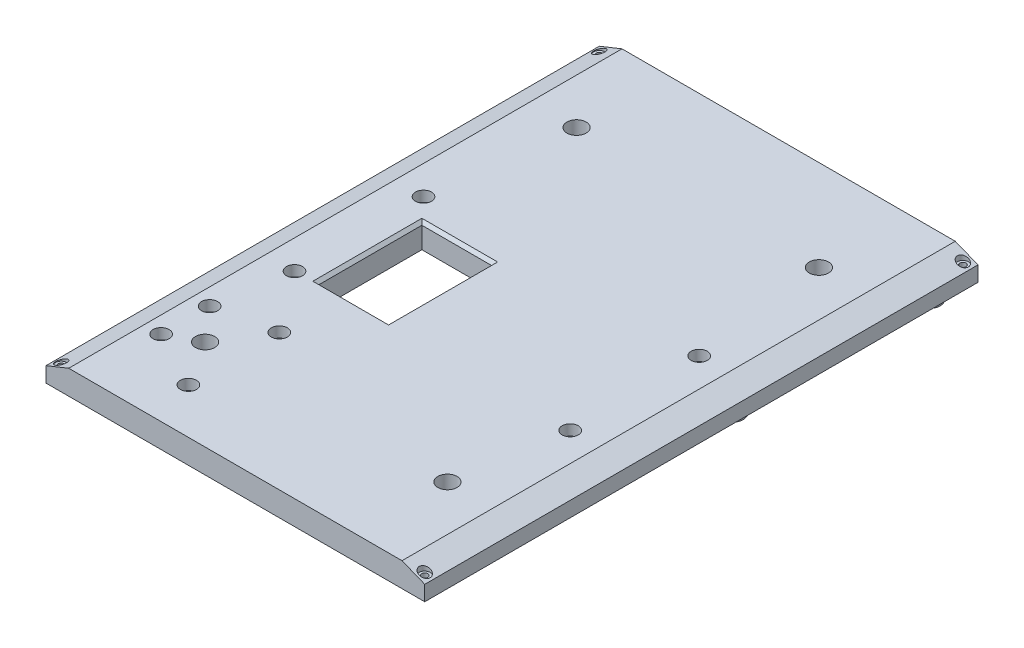
from build123d import *

# Parameters (mm, degrees)
BOSS_EXTRUDE1_DEPTH = 182.6
SKETCH2_R           = 2.5
SKETCH2_R_2         = 0.85
BOSS_EXTRUDE2_DEPTH = 3
SKETCH3_R           = 3.175
CUT_EXTRUDE1_DEPTH  = 15
SKETCH4_R           = 2.6
SKETCH4_R_2         = 1.55
BOSS_EXTRUDE3_DEPTH = 6
SKETCH7_R           = 1.6
CUT_EXTRUDE3_DEPTH  = 10
SKETCH8_R           = 1.6
CUT_EXTRUDE4_DEPTH  = 10
SKETCH6_R           = 0.85
CUT_EXTRUDE2_DEPTH  = 7
SKETCH9_R           = 3.5
SKETCH9_R_2         = 1.95
BOSS_EXTRUDE4_DEPTH = 5
SKETCH10_R          = 1.6
CUT_EXTRUDE5_DEPTH  = 10
SKETCH11_W          = 23
SKETCH11_H          = 34
CUT_EXTRUDE6_DEPTH  = 10
CHAMFER1_SIZE       = 1
SKETCH12_R          = 2.65
CUT_EXTRUDE7_DEPTH  = 3.5
SKETCH13_R          = 1.05
CUT_EXTRUDE8_DEPTH  = 8
SKETCH15_R          = 1.8
CUT_EXTRUDE9_DEPTH  = 3


with BuildPart() as part:
    # Sketch1 → Boss-Extrude1 (new body)
    with BuildSketch(Plane.XY):
        Polygon((0, 5), (7.5, 8), (117.5, 8), (125, 5), (125, 0), (0, 0), align=None)
    extrude(amount=BOSS_EXTRUDE1_DEPTH)

    # Sketch2 → Boss-Extrude2 (add)
    # profile 1 of 4: a face of its own
    with BuildSketch(Plane.XZ):
        with Locations(Location((40, 173.1, 0), (0, 0, 90))):
            Circle(SKETCH2_R)
        with Locations(Location((40, 173.1, 0), (0, 0, 270))):
            Circle(SKETCH2_R_2, mode=Mode.SUBTRACT)
    # profile 2 of 4: a face of its own
    with BuildSketch(Plane.XZ):
        with Locations(Location((98, 173.1, 0), (0, 0, 90))):
            Circle(SKETCH2_R)
        with Locations(Location((98, 173.1, 0), (0, 0, 270))):
            Circle(SKETCH2_R_2, mode=Mode.SUBTRACT)
    # profile 3 of 4: a face of its own
    with BuildSketch(Plane.XZ):
        with Locations(Location((98, 124.1, 0), (0, 0, 90))):
            Circle(SKETCH2_R)
        with Locations(Location((98, 124.1, 0), (0, 0, 90))):
            Circle(SKETCH2_R_2, mode=Mode.SUBTRACT)
    # profile 4 of 4: a face of its own
    with BuildSketch(Plane.XZ):
        with Locations(Location((40, 124.1, 0), (0, 0, 90))):
            Circle(SKETCH2_R)
        with Locations(Location((40, 124.1, 0), (0, 0, 90))):
            Circle(SKETCH2_R_2, mode=Mode.SUBTRACT)
    extrude(amount=BOSS_EXTRUDE2_DEPTH)

    # Sketch3 → Cut-Extrude1 (cut)
    with BuildSketch(Plane(origin=(0, 8, 0), x_dir=(1, 0, 0), z_dir=(0, 1, 0))):
        with Locations(Location((22.5, -152.6, 0), (0, 0, 270))):
            Circle(SKETCH3_R)
        with Locations(Location((102.5, -152.6, 0), (0, 0, 270))):
            Circle(SKETCH3_R)
        with Locations(Location((102.5, -30, 0), (0, 0, 270))):
            Circle(SKETCH3_R)
        with Locations(Location((22.5, -30, 0), (0, 0, 270))):
            Circle(SKETCH3_R)
    extrude(amount=-CUT_EXTRUDE1_DEPTH, mode=Mode.SUBTRACT)

    # Sketch4 → Boss-Extrude3 (add)
    # profile 1 of 4: a face of its own
    with BuildSketch(Plane.XZ):
        with Locations(Location((56.15, 81.14, 0), (0, 0, 90))):
            Circle(SKETCH4_R)
        with Locations(Location((56.15, 81.14, 0), (0, 0, 270))):
            Circle(SKETCH4_R_2, mode=Mode.SUBTRACT)
    # profile 2 of 4: a face of its own
    with BuildSketch(Plane.XZ):
        with Locations(Location((68.85, 81.14, 0), (0, 0, 90))):
            Circle(SKETCH4_R)
        with Locations(Location((68.85, 81.14, 0), (0, 0, 270))):
            Circle(SKETCH4_R_2, mode=Mode.SUBTRACT)
    # profile 3 of 4: a face of its own
    with BuildSketch(Plane.XZ):
        with Locations(Location((68.85, 101.46, 0), (0, 0, 90))):
            Circle(SKETCH4_R)
        with Locations(Location((68.85, 101.46, 0), (0, 0, 270))):
            Circle(SKETCH4_R_2, mode=Mode.SUBTRACT)
    # profile 4 of 4: a face of its own
    with BuildSketch(Plane.XZ):
        with Locations(Location((56.15, 101.46, 0), (0, 0, 90))):
            Circle(SKETCH4_R)
        with Locations(Location((56.15, 101.46, 0), (0, 0, 270))):
            Circle(SKETCH4_R_2, mode=Mode.SUBTRACT)
    extrude(amount=BOSS_EXTRUDE3_DEPTH)

    # Sketch7 → Cut-Extrude3 (cut)
    with BuildSketch(Plane(origin=(0, 8, 0), x_dir=(1, 0, 0), z_dir=(0, 1, 0))):
        with Locations(Location((17, -75.01, 0), (0, 0, 270))):
            Circle(SKETCH7_R)
        with Locations(Location((17, -117.585, 0), (0, 0, 270))):
            Circle(SKETCH7_R)
        with Locations(Location((108, -75.01, 0), (0, 0, 270))):
            Circle(SKETCH7_R)
        with Locations(Location((108, -117.59, 0), (0, 0, 270))):
            Circle(SKETCH7_R)
    extrude(amount=-CUT_EXTRUDE3_DEPTH, mode=Mode.SUBTRACT)

    # Sketch8 → Cut-Extrude4 (cut)
    with BuildSketch(Plane(origin=(0, 8, 0), x_dir=(1, 0, 0), z_dir=(0, 1, 0))):
        with Locations(Location((13, -141.6, 0), (0, 0, 270))):
            Circle(SKETCH8_R)
        with Locations(Location((13, -157.6, 0), (0, 0, 270))):
            Circle(SKETCH8_R)
    extrude(amount=-CUT_EXTRUDE4_DEPTH, mode=Mode.SUBTRACT)

    # Sketch6 → Cut-Extrude2 (cut)
    with BuildSketch(Plane.XZ):
        with Locations(Location((22.407582627, 118.246238122, 0), (0, 0, 270))):
            Circle(SKETCH6_R)
        with Locations(Location((48.407582627, 118.246238122, 0), (0, 0, 270))):
            Circle(SKETCH6_R)
        with Locations(Location((48.407582627, 71.246238122, 0), (0, 0, 270))):
            Circle(SKETCH6_R)
        with Locations(Location((22.407582627, 71.246238122, 0), (0, 0, 270))):
            Circle(SKETCH6_R)
    extrude(amount=-CUT_EXTRUDE2_DEPTH, mode=Mode.SUBTRACT)

    # Sketch9 → Boss-Extrude4 (add)
    # profile 1 of 4: a face of its own
    with BuildSketch(Plane.XZ):
        with Locations(Location((117, 73, 0), (0, 0, 90))):
            Circle(SKETCH9_R)
        with Locations(Location((117, 73, 0), (0, 0, 270))):
            Circle(SKETCH9_R_2, mode=Mode.SUBTRACT)
    # profile 2 of 4: a face of its own
    with BuildSketch(Plane.XZ):
        with Locations(Location((117, 8, 0), (0, 0, 90))):
            Circle(SKETCH9_R)
        with Locations(Location((117, 8, 0), (0, 0, 270))):
            Circle(SKETCH9_R_2, mode=Mode.SUBTRACT)
    # profile 3 of 4: a face of its own
    with BuildSketch(Plane.XZ):
        with Locations(Location((34, 8, 0), (0, 0, 90))):
            Circle(SKETCH9_R)
        with Locations(Location((34, 8, 0), (0, 0, 270))):
            Circle(SKETCH9_R_2, mode=Mode.SUBTRACT)
    # profile 4 of 4: a face of its own
    with BuildSketch(Plane.XZ):
        with Locations(Location((34, 73, 0), (0, 0, 90))):
            Circle(SKETCH9_R)
        with Locations(Location((34, 73, 0), (0, 0, 270))):
            Circle(SKETCH9_R_2, mode=Mode.SUBTRACT)
    extrude(amount=BOSS_EXTRUDE4_DEPTH)

    # Sketch10 → Cut-Extrude5 (cut)
    with BuildSketch(Plane(origin=(0, 8, 0), x_dir=(1, 0, 0), z_dir=(0, 1, 0))):
        with Locations(Location((32, -137.6, 0), (0, 0, 270))):
            Circle(SKETCH10_R)
        with Locations(Location((32, -167.6, 0), (0, 0, 270))):
            Circle(SKETCH10_R)
    extrude(amount=-CUT_EXTRUDE5_DEPTH, mode=Mode.SUBTRACT)

    # Sketch11 → Cut-Extrude6 (cut)
    with BuildSketch(Plane.XZ):
        with Locations((35.407582627, 99.446238122)):
            Rectangle(SKETCH11_W, SKETCH11_H)
    extrude(amount=-CUT_EXTRUDE6_DEPTH, mode=Mode.SUBTRACT)

    # Chamfer1
    chamfer1_edges = [part.edges().sort_by_distance(p)[0] for p in [
        (35.407582627, 8, 116.446238122),
        (23.907582627, 8, 99.446238122),
        (35.407582627, 8, 82.446238122),
        (46.907582627, 8, 99.446238122),
    ]]
    chamfer(chamfer1_edges, length=CHAMFER1_SIZE)

    # Sketch12 → Cut-Extrude7 (cut)
    with BuildSketch(Plane(origin=(0, 8, 0), x_dir=(1, 0, 0), z_dir=(0, 1, 0))):
        with Locations(Location((17, -75.01, 0), (0, 0, 270))):
            Circle(SKETCH12_R)
        with Locations(Location((108, -75.01, 0), (0, 0, 270))):
            Circle(SKETCH12_R)
        with Locations(Location((108, -117.59, 0), (0, 0, 270))):
            Circle(SKETCH12_R)
        with Locations(Location((32, -137.6, 0), (0, 0, 270))):
            Circle(SKETCH12_R)
        with Locations(Location((32, -167.6, 0), (0, 0, 270))):
            Circle(SKETCH12_R)
        with Locations(Location((13, -157.6, 0), (0, 0, 270))):
            Circle(SKETCH12_R)
        with Locations(Location((13, -141.6, 0), (0, 0, 270))):
            Circle(SKETCH12_R)
        with Locations(Location((17, -117.585, 0), (0, 0, 270))):
            Circle(SKETCH12_R)
    extrude(amount=-CUT_EXTRUDE7_DEPTH, mode=Mode.SUBTRACT)

    # Sketch13 → Cut-Extrude8 (cut)
    with BuildSketch(Plane(origin=(0, 8, 0), x_dir=(1, 0, 0), z_dir=(0, 1, 0))):
        with Locations(Location((2.5, -180.1, 0), (0, 0, 270))):
            Circle(SKETCH13_R)
        with Locations(Location((122.5, -180.1, 0), (0, 0, 270))):
            Circle(SKETCH13_R)
        with Locations(Location((122.5, -2.5, 0), (0, 0, 270))):
            Circle(SKETCH13_R)
        with Locations(Location((2.5, -2.5, 0), (0, 0, 270))):
            Circle(SKETCH13_R)
    extrude(amount=-CUT_EXTRUDE8_DEPTH, mode=Mode.SUBTRACT)

    # Sketch15 → Cut-Extrude9 (cut)
    with BuildSketch(Plane(origin=(0, 8, 0), x_dir=(1, 0, 0), z_dir=(0, 1, 0))):
        with Locations(Location((2.5, -180.1, 0), (0, 0, 270))):
            Circle(SKETCH15_R)
        with Locations(Location((2.5, -2.5, 0), (0, 0, 270))):
            Circle(SKETCH15_R)
        with Locations(Location((122.5, -2.5, 0), (0, 0, 270))):
            Circle(SKETCH15_R)
        with Locations(Location((122.5, -180.1, 0), (0, 0, 270))):
            Circle(SKETCH15_R)
    extrude(amount=-CUT_EXTRUDE9_DEPTH, mode=Mode.SUBTRACT)


solid = part.part
